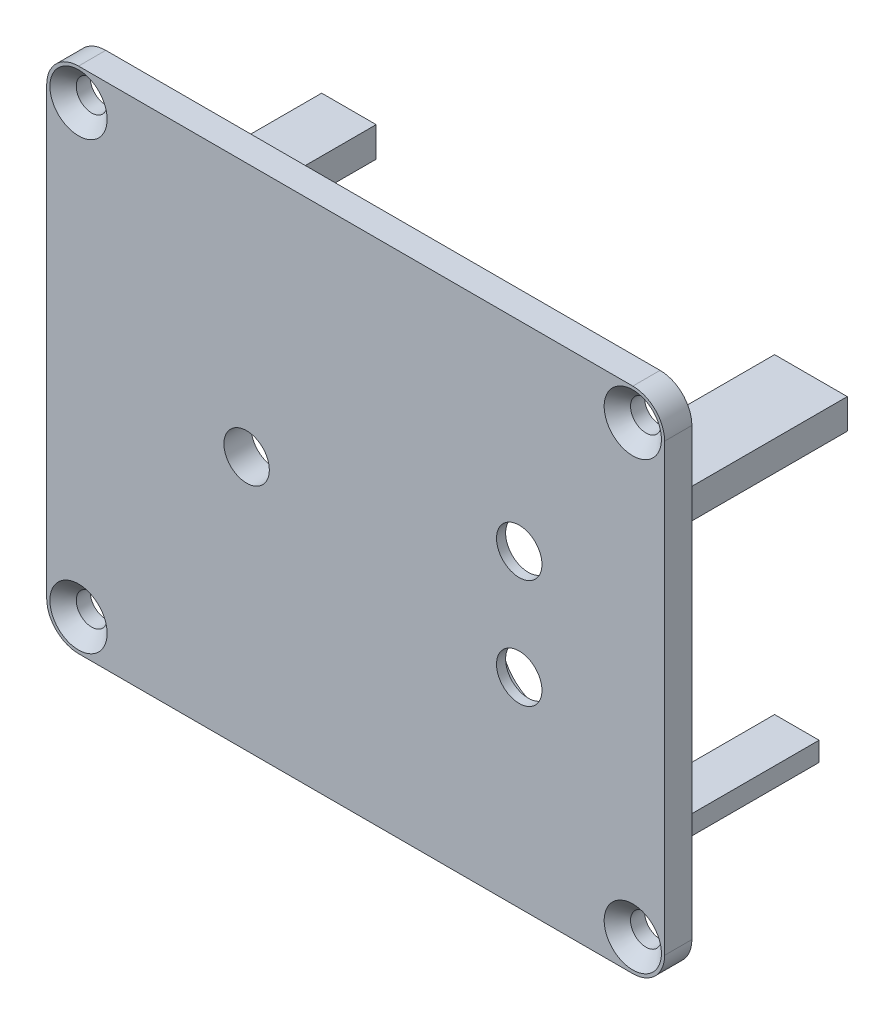
from build123d import *

# Parameters (mm, degrees)
ESQUISSE1_W                                    = 68
ESQUISSE1_H                                    = 56
BOSS_EXTRU_1_DEPTH                             = 1.5
ENL_V_MAT_EXTRU_1_REACH                        = 68.114
ESQUISSE2_R                                    = 2.5
CONG_1_R                                       = 3.5
FRAISAGE_POUR_VIS_T_TE_FRAIS_E_M31_D           = 3.4
FRAISAGE_POUR_VIS_T_TE_FRAIS_E_M31_DEPTH       = 21.67
FRAISAGE_POUR_VIS_T_TE_FRAIS_E_M31_CSINK_D     = 6.3
FRAISAGE_POUR_VIS_T_TE_FRAIS_E_M31_CSINK_ANGLE = 90
FRAISAGE_POUR_VIS_T_TE_FRAIS_E_M31_TIP         = 1.021463052
BOSS_EXTRU_2_DEPTH                             = 22
ENL_V_MAT_EXTRU_2_DEPTH                        = 2


with BuildPart() as part:
    # Esquisse1 → Boss.-Extru.1 (new, symmetric)
    with BuildSketch(Plane.XY):
        Rectangle(ESQUISSE1_W, ESQUISSE1_H)
    extrude(amount=BOSS_EXTRU_1_DEPTH, both=True)

    # Esquisse2 → Enlèv. mat.-Extru.1 (cut, up to next)
    with BuildSketch(Plane(origin=(-25.81698593, 0, 1.5), x_dir=(1, 0, 0), z_dir=(0, 0, 1)), mode=Mode.PRIVATE) as enl_v_mat_extru_1_sk1:
        with Locations((13.81698593, 0)):
            Circle(ESQUISSE2_R)
    enl_v_mat_extru_1_tool1 = extrude(enl_v_mat_extru_1_sk1.sketch, amount=-ENL_V_MAT_EXTRU_1_REACH, mode=Mode.PRIVATE) & part.part
    # Esquisse2 → Enlèv. mat.-Extru.1 (cut, up to next)
    with BuildSketch(Plane(origin=(-25.81698593, 0, 1.5), x_dir=(1, 0, 0), z_dir=(0, 0, 1)), mode=Mode.PRIVATE) as enl_v_mat_extru_1_sk2:
        with Locations((43.81698593, 6)):
            Circle(ESQUISSE2_R)
    enl_v_mat_extru_1_tool2 = extrude(enl_v_mat_extru_1_sk2.sketch, amount=-ENL_V_MAT_EXTRU_1_REACH, mode=Mode.PRIVATE) & part.part
    # Esquisse2 → Enlèv. mat.-Extru.1 (cut, up to next)
    with BuildSketch(Plane(origin=(-25.81698593, 0, 1.5), x_dir=(1, 0, 0), z_dir=(0, 0, 1)), mode=Mode.PRIVATE) as enl_v_mat_extru_1_sk3:
        with Locations((43.81698593, -6)):
            Circle(ESQUISSE2_R)
    enl_v_mat_extru_1_tool3 = extrude(enl_v_mat_extru_1_sk3.sketch, amount=-ENL_V_MAT_EXTRU_1_REACH, mode=Mode.PRIVATE) & part.part
    add(enl_v_mat_extru_1_tool1.solids().sort_by_distance((-12, 0, 1.5))[0], mode=Mode.SUBTRACT)
    add(enl_v_mat_extru_1_tool2.solids().sort_by_distance((18, 6, 1.5))[0], mode=Mode.SUBTRACT)
    add(enl_v_mat_extru_1_tool3.solids().sort_by_distance((18, -6, 1.5))[0], mode=Mode.SUBTRACT)

    # Congé1
    cong_1_edges = [part.edges().sort_by_distance(p)[0] for p in [
        (34, -28, 0),
        (-34, -28, 0),
        (-34, 28, 0),
        (34, 28, 0),
    ]]
    fillet(cong_1_edges, radius=CONG_1_R)

    # Fraisage pour vis à tête fraisée M31
    with Locations(Plane.XY.offset(1.5)):
        with Locations((-30.5, -24.5), (-30.5, 24.5), (30.5, 24.5), (30.5, -24.5)):
            CounterSinkHole(FRAISAGE_POUR_VIS_T_TE_FRAIS_E_M31_D / 2, FRAISAGE_POUR_VIS_T_TE_FRAIS_E_M31_CSINK_D / 2, depth=FRAISAGE_POUR_VIS_T_TE_FRAIS_E_M31_DEPTH, counter_sink_angle=FRAISAGE_POUR_VIS_T_TE_FRAIS_E_M31_CSINK_ANGLE)
            with Locations((0, 0, -(FRAISAGE_POUR_VIS_T_TE_FRAIS_E_M31_DEPTH + FRAISAGE_POUR_VIS_T_TE_FRAIS_E_M31_TIP / 2))):  # 118° drill point
                Cone(0, FRAISAGE_POUR_VIS_T_TE_FRAIS_E_M31_D / 2, FRAISAGE_POUR_VIS_T_TE_FRAIS_E_M31_TIP, mode=Mode.SUBTRACT)

    # Esquisse6 → Boss.-Extru.2 (add)
    with BuildSketch(Plane(origin=(0, 0, -1.5), x_dir=(-1, 0, 0), z_dir=(0, 0, -1))):
        Polygon((-21.103469563, -20.5), (-26, -20.5), (-26, -22.621320344), (-24.082132084, -24.539188259), (-21.103469563, -24.539188259), align=None)
        Polygon((22.741804985, 10.5), (27.5, 10.5), (28.741804985, 10.5), (28.741804985, 13.8), (22.741804985, 13.8), align=None)
        Polygon((-21.103469563, 10.5), (-26, 10.5), (-29.103469563, 10.5), (-29.103469563, 13.8), (-21.103469563, 13.8), align=None)
    extrude(amount=BOSS_EXTRU_2_DEPTH)

    # Esquisse7 → Enlèv. mat.-Extru.2 (cut)
    with BuildSketch(Plane(origin=(0, 0, -1.5), x_dir=(-1, 0, 0), z_dir=(0, 0, -1))):
        with BuildLine():
            Line((-23, -6), (-23, 6))
            ThreePointArc((-23, 6), (-18, 11), (-13, 6))
            Line((-13, 6), (-13, -6))
            ThreePointArc((-13, -6), (-18, -11), (-23, -6))
        make_face()
    extrude(amount=-ENL_V_MAT_EXTRU_2_DEPTH, mode=Mode.SUBTRACT)


solid = part.part
